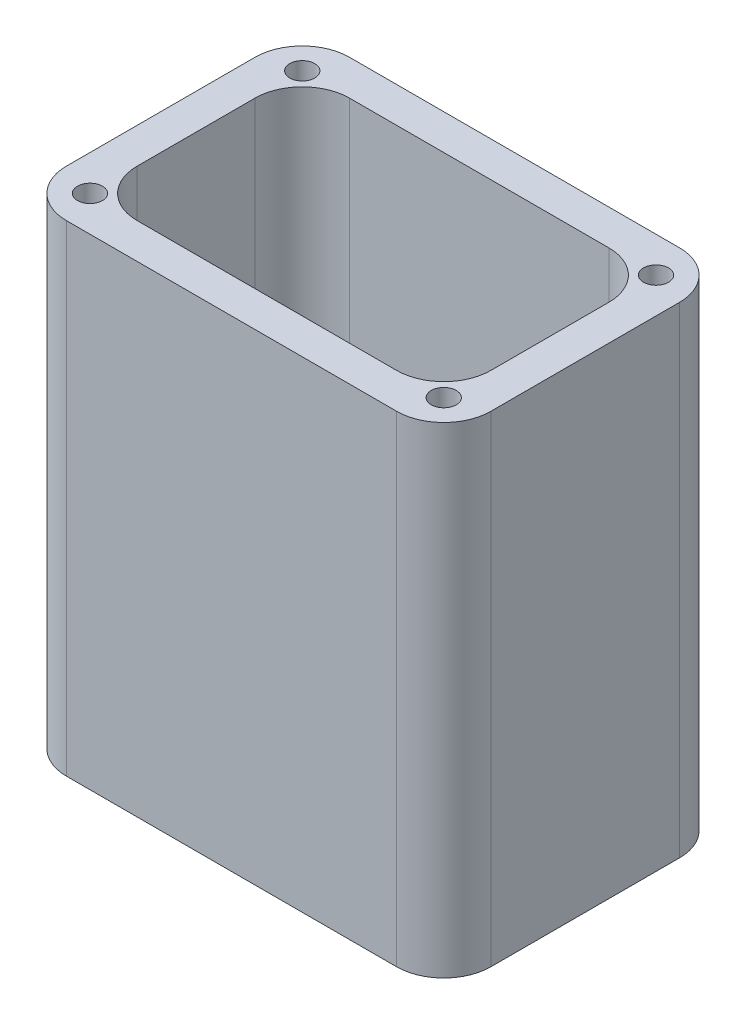
from build123d import *

# Parameters (mm, degrees)
SKETCH_1_R      = 2.65
EXTRUDE_1_DEPTH = 102


with BuildPart() as part:
    # 草图1 → 凸台-拉伸1 (new body)
    with BuildSketch(Plane(origin=(0, 0, 0), x_dir=(1, 0, 0), z_dir=(0, 1, 0))):
        with BuildLine():
            Line((-35, 30), (35, 30))
            ThreePointArc((35, 30), (42.071067812, 27.071067812), (45, 20))
            Line((45, 20), (45, -20))
            ThreePointArc((45, -20), (42.071067812, -27.071067812), (35, -30))
            Line((35, -30), (-35, -30))
            ThreePointArc((-35, -30), (-42.071067812, -27.071067812), (-45, -20))
            Line((-45, -20), (-45, 20))
            ThreePointArc((-45, 20), (-42.071067812, 27.071067812), (-35, 30))
        make_face()
        with Locations(Location((-37.5, 22.5, 0), (0, 0, 270))):
            Circle(SKETCH_1_R, mode=Mode.SUBTRACT)
        with Locations(Location((37.5, 22.5, 0), (0, 0, 90))):
            Circle(SKETCH_1_R, mode=Mode.SUBTRACT)
        with Locations(Location((37.5, -22.5, 0), (0, 0, 270))):
            Circle(SKETCH_1_R, mode=Mode.SUBTRACT)
        with Locations(Location((-37.5, -22.5, 0), (0, 0, 90))):
            Circle(SKETCH_1_R, mode=Mode.SUBTRACT)
        with BuildLine():
            Line((-27.5, 22.5), (27.5, 22.5))
            ThreePointArc((27.5, 22.5), (34.571067812, 19.571067812), (37.5, 12.5))
            Line((37.5, 12.5), (37.5, -12.5))
            ThreePointArc((37.5, -12.5), (34.571067812, -19.571067812), (27.5, -22.5))
            Line((27.5, -22.5), (-27.5, -22.5))
            ThreePointArc((-27.5, -22.5), (-34.571067812, -19.571067812), (-37.5, -12.5))
            Line((-37.5, -12.5), (-37.5, 12.5))
            ThreePointArc((-37.5, 12.5), (-34.571067812, 19.571067812), (-27.5, 22.5))
        make_face(mode=Mode.SUBTRACT)
    extrude(amount=EXTRUDE_1_DEPTH)


solid = part.part
